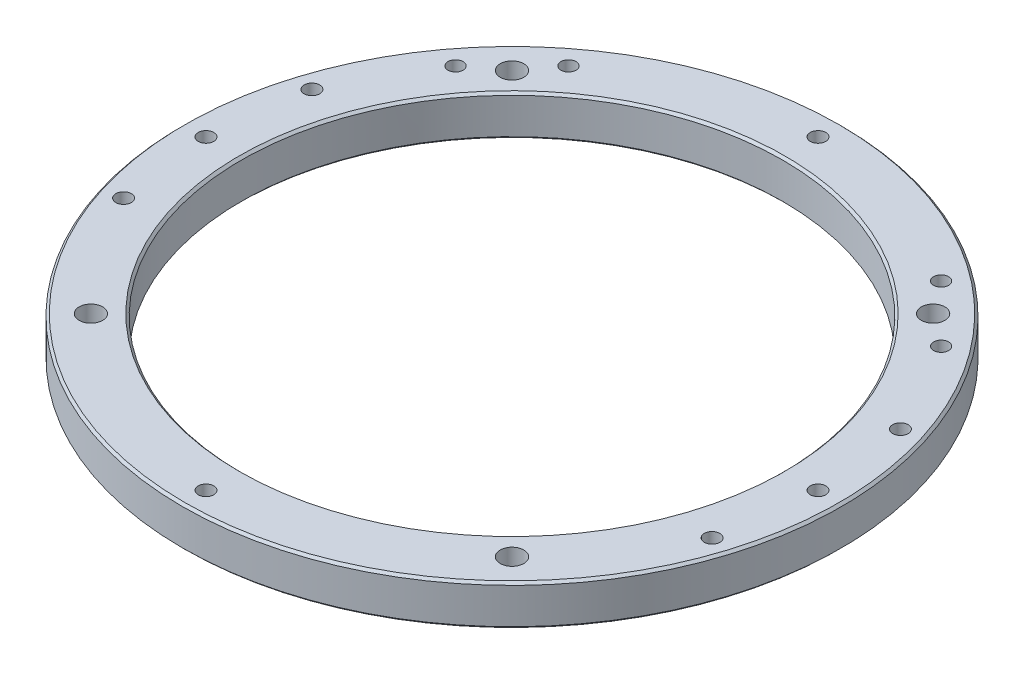
from build123d import *

# Parameters (mm, degrees)
SKETCH_1_R          = 70
SKETCH_1_R_2        = 57.5
EXTRUDE_1_DEPTH     = 8.6
SKETCH_2_R          = 2.5
CUT_EXTRUDE_1_DEPTH = 100.367801626
CHAMFER_1_SIZE      = 0.5
SKETCH_3_R          = 1.65
CUT_EXTRUDE_2_DEPTH = 100.367801626
SKETCH_4_R          = 1.6
CUT_EXTRUDE_3_DEPTH = 100.367801626


with BuildPart() as part:
    # ｽｹｯﾁ1 → ﾎﾞｽ - 押し出し1 (new body)
    with BuildSketch(Plane(origin=(0, 0, 0), x_dir=(1, 0, 0), z_dir=(0, 1, 0))):
        with Locations(Location((0, 0, 0), (0, 0, 90))):
            Circle(SKETCH_1_R)
        with Locations(Location((0, 0, 0), (0, 0, 90))):
            Circle(SKETCH_1_R_2, mode=Mode.SUBTRACT)
    extrude(amount=EXTRUDE_1_DEPTH)

    # ｽｹｯﾁ2 → ｶｯﾄ - 押し出し1 (cut, through all)
    with BuildSketch(Plane(origin=(0, 8.6, 0), x_dir=(1, 0, 0), z_dir=(0, 1, 0))):
        with Locations(Location((-44.72450391, 44.72450391, 0), (0, 0, 270))):
            Circle(SKETCH_2_R)
        with Locations(Location((44.72450391, 44.72450391, 0), (0, 0, 270))):
            Circle(SKETCH_2_R)
        with Locations(Location((44.72450391, -44.72450391, 0), (0, 0, 270))):
            Circle(SKETCH_2_R)
        with Locations(Location((-44.72450391, -44.72450391, 0), (0, 0, 270))):
            Circle(SKETCH_2_R)
    extrude(amount=-CUT_EXTRUDE_1_DEPTH, mode=Mode.SUBTRACT)

    # 面取り1
    chamfer_1_edges = [part.edges().sort_by_distance(p)[0] for p in [
        (0, 0, 70),
        (0, 8.6, 70),
        (0, 0, 57.5),
        (0, 8.6, 57.5),
    ]]
    chamfer(chamfer_1_edges, length=CHAMFER_1_SIZE)

    # ｽｹｯﾁ3 → ｶｯﾄ - 押し出し2 (cut, through all)
    with BuildSketch(Plane(origin=(0, 8.6, 0), x_dir=(1, 0, 0), z_dir=(0, 1, 0))):
        with Locations(Location((65, 0, 0), (0, 0, 270))):
            Circle(SKETCH_3_R)
        with Locations(Location((0, -65, 0), (0, 0, 270))):
            Circle(SKETCH_3_R)
        with Locations(Location((-65, 0, 0), (0, 0, 270))):
            Circle(SKETCH_3_R)
        with Locations(Location((0, 65, 0), (0, 0, 270))):
            Circle(SKETCH_3_R)
        with Locations(Location((-62.5, 20, 0), (0, 0, 270))):
            Circle(SKETCH_3_R)
        with Locations(Location((62.5, 20, 0), (0, 0, 270))):
            Circle(SKETCH_3_R)
        with Locations(Location((62.5, -20, 0), (0, 0, 270))):
            Circle(SKETCH_3_R)
        with Locations(Location((-62.5, -20, 0), (0, 0, 270))):
            Circle(SKETCH_3_R)
    extrude(amount=-CUT_EXTRUDE_2_DEPTH, mode=Mode.SUBTRACT)

    # ｽｹｯﾁ4 → ｶｯﾄ - 押し出し3 (cut, through all)
    with BuildSketch(Plane(origin=(0, 8.6, 0), x_dir=(1, 0, 0), z_dir=(0, 1, 0))):
        with Locations(Location((51.567967119, 39.569492886, 0), (0, 0, 270))):
            Circle(SKETCH_4_R)
        with Locations(Location((39.569492886, 51.567967119, 0), (0, 0, 270))):
            Circle(SKETCH_4_R)
        with Locations(Location((-39.569492886, 51.567967119, 0), (0, 0, 270))):
            Circle(SKETCH_4_R)
        with Locations(Location((-51.567967119, 39.569492886, 0), (0, 0, 270))):
            Circle(SKETCH_4_R)
    extrude(amount=-CUT_EXTRUDE_3_DEPTH, mode=Mode.SUBTRACT)


solid = part.part
